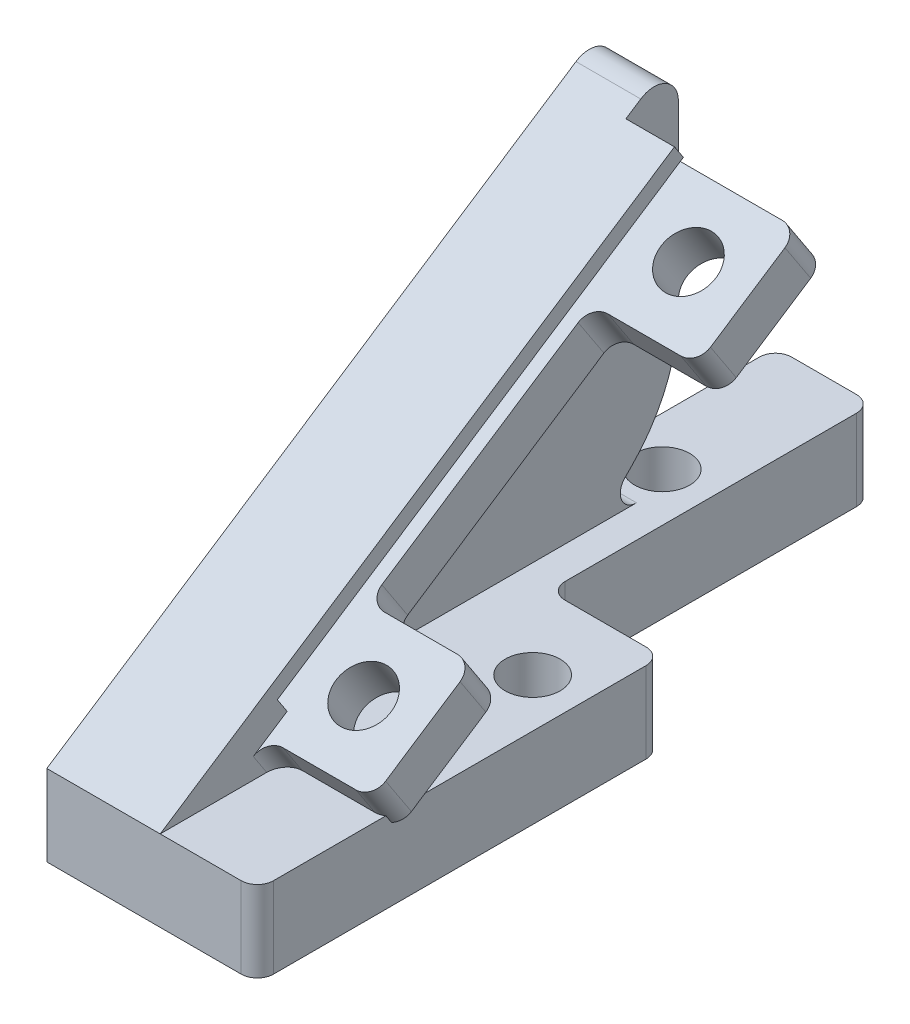
from build123d import *

# Parameters (mm, degrees)
EXTRUDE_1_DEPTH                = 5
EXTRUDE_3_DEPTH                = 4
EXTRUDE_4_DEPTH                = 3
CUT_EXTRUDE_1_DEPTH            = 2
SKETCH_6_R                     = 1.7
CUT_EXTRUDE_1_2_DEPTH          = 5.5
EXTRUDE_5_DEPTH                = 6.5
FILLET_1_R                     = 1
CUT_EXTRUDE_2_REACH            = 56.175
SKETCH_8_R                     = 1.7
FILLET_2_R                     = 1
PATTERN_LINEAR_2_COUNT         = 2
PATTERN_LINEAR_2_PITCH         = 24
FILLET_1_OF_PATTERN_LINEAR_2_R = 1
FILLET_2_OF_PATTERN_LINEAR_2_R = 1
FILLET_3_R                     = 1
FILLET_4_R                     = 1


with BuildPart() as part:
    # 草图1 → 凸台-拉伸1 (new body)
    with BuildSketch(Plane(origin=(0, 0, 0), x_dir=(1, 0, 0), z_dir=(0, 1, 0))):
        with BuildLine():
            Line((0, 0), (0, 44))
            ThreePointArc((0, 44), (0.292893219, 44.707106781), (1, 45))
            Line((1, 45), (5, 45))
            ThreePointArc((5, 45), (5.707106781, 44.707106781), (6, 44))
            Line((6, 44), (6, 26))
            ThreePointArc((6, 26), (6.292893219, 25.292893219), (7, 25))
            Line((7, 25), (12, 25))
            ThreePointArc((12, 25), (12.707106781, 24.707106781), (13, 24))
            Line((13, 24), (13, 1))
            ThreePointArc((13, 1), (12.707106781, 0.292893219), (12, 0))
            Line((12, 0), (0, 0))
        make_face()
    extrude(amount=EXTRUDE_1_DEPTH)

    # 草图3 → 凸台-拉伸3 (add)
    with BuildSketch(Plane(origin=(0, 0, 0), x_dir=(0, 0, -1), z_dir=(1, 0, 0))):
        with BuildLine():
            Line((30, 5), (0, 5))
            Line((0, 5), (32.676465773, 26.464426075))
            ThreePointArc((32.676465773, 26.464426075), (34.212284585, 26.53080998), (35, 25.210715033))
            Line((35, 25.210715033), (35, 14.142135624))
            ThreePointArc((35, 14.142135624), (34.238795325, 10.3153013), (32.071067812, 7.071067812))
            Line((32.071067812, 7.071067812), (30, 5))
        make_face()
    extrude(amount=EXTRUDE_3_DEPTH)

    # 草图4 → 凸台-拉伸4 (add)
    with BuildSketch(Plane(origin=(4, 0, 0), x_dir=(0, 0, -1), z_dir=(1, 0, 0))):
        Polygon((0, 5), (31.760679732, 25.862867084), (34.505793822, 21.683830277), (9.107089607, 5), align=None)
    extrude(amount=EXTRUDE_4_DEPTH)

    # 草图5 → Cut-Extrude 1 (cut)
    with BuildSketch(Plane(origin=(7, 0, 0), x_dir=(0, 0, -1), z_dir=(1, 0, 0))):
        Polygon((32.30970255, 25.027059723), (7.235481709, 8.556375183), (7.839406809, 7.636987085), (32.91362765, 24.107671625), align=None)
    extrude(amount=-CUT_EXTRUDE_1_DEPTH, mode=Mode.SUBTRACT)

    # 草图6 → Cut-Extrude 1 2 (cut)
    with BuildSketch(Plane.XZ):
        with Locations(Location((3, -5, 0), (0, 0, 270))):
            Circle(SKETCH_6_R)
        with Locations(Location((3, -35, 0), (0, 0, 270))):
            Circle(SKETCH_6_R)
        with Locations(Location((10, -20, 0), (0, 0, 270))):
            Circle(SKETCH_6_R)
    extrude(amount=-CUT_EXTRUDE_1_2_DEPTH, mode=Mode.SUBTRACT)

    # 草图7 → 凸台-拉伸5 (add)
    with BuildSketch(Plane(origin=(7, 0, 0), x_dir=(0, 0, -1), z_dir=(1, 0, 0))):
        Polygon((32.91362765, 24.107671625), (34.505793822, 21.683830277), (28.237238612, 17.566159142), (26.64507244, 19.99000049), align=None)
    extrude_5 = extrude(amount=EXTRUDE_5_DEPTH)

    # 圆角1
    fillet_1_edges = [part.edges().sort_by_distance(p)[0] for p in [
        (13.5, 18.778079816, -27.441155526),
        (13.5, 22.895750951, -33.709710736),
    ]]
    fillet(fillet_1_edges, radius=FILLET_1_R)

    # 草图8 → 切除-拉伸2 (cut, up to next)
    with BuildSketch(Plane(origin=(0, 1.737674268, 1.141438646), x_dir=(1, 0, 0), z_dir=(0, 0.8358073613682734, 0.549022817998127)), mode=Mode.PRIVATE) as cut_extrude_2_sk1:
        with Locations(Location((9.8, 37.04511409, 0), (0, 0, 270))):
            Circle(SKETCH_8_R)
    cut_extrude_2_tool1 = extrude(cut_extrude_2_sk1.sketch, amount=-CUT_EXTRUDE_2_REACH, mode=Mode.PRIVATE) & part.part
    cut_extrude_2 = cut_extrude_2_tool1.solids().sort_by_distance((9.8, 22.076287, -29.82114))[0]
    add(cut_extrude_2, mode=Mode.SUBTRACT)

    # 圆角2
    fillet_2_edges = [part.edges().sort_by_distance(p)[0] for p in [
        (7, 18.778079816, -27.441155526),
    ]]
    fillet(fillet_2_edges, radius=FILLET_2_R)

    # 阵列(线性)2: 凸台-拉伸5, 切除-拉伸2 ×2
    with Locations(*[Vector(0, -0.549022817998128, 0.8358073613682727) * (i * PATTERN_LINEAR_2_PITCH) for i in range(1, PATTERN_LINEAR_2_COUNT)]):
        add(extrude_5)
        add(cut_extrude_2, mode=Mode.SUBTRACT)

    # 圆角1 of 阵列(线性)2
    fillet_1_of_pattern_linear_2_edges = [part.edges().sort_by_distance(p)[0] for p in [
        (13.5, 5.601532184, -7.381778853),
        (13.5, 9.719203319, -13.650334063),
    ]]
    fillet(fillet_1_of_pattern_linear_2_edges, radius=FILLET_1_OF_PATTERN_LINEAR_2_R)

    # 圆角2 of 阵列(线性)2
    fillet_2_of_pattern_linear_2_edges = [part.edges().sort_by_distance(p)[0] for p in [
        (7, 5.601532184, -7.381778853),
    ]]
    fillet(fillet_2_of_pattern_linear_2_edges, radius=FILLET_2_OF_PATTERN_LINEAR_2_R)

    # 圆角3
    fillet_3_edges = [part.edges().sort_by_distance(p)[0] for p in [
        (7, 9.719203319, -13.650334063),
    ]]
    fillet(fillet_3_edges, radius=FILLET_3_R)

    # 圆角4
    fillet_4_edges = [part.edges().sort_by_distance(p)[0] for p in [
        (2, 5, -30),
    ]]
    fillet(fillet_4_edges, radius=FILLET_4_R)


solid = part.part
